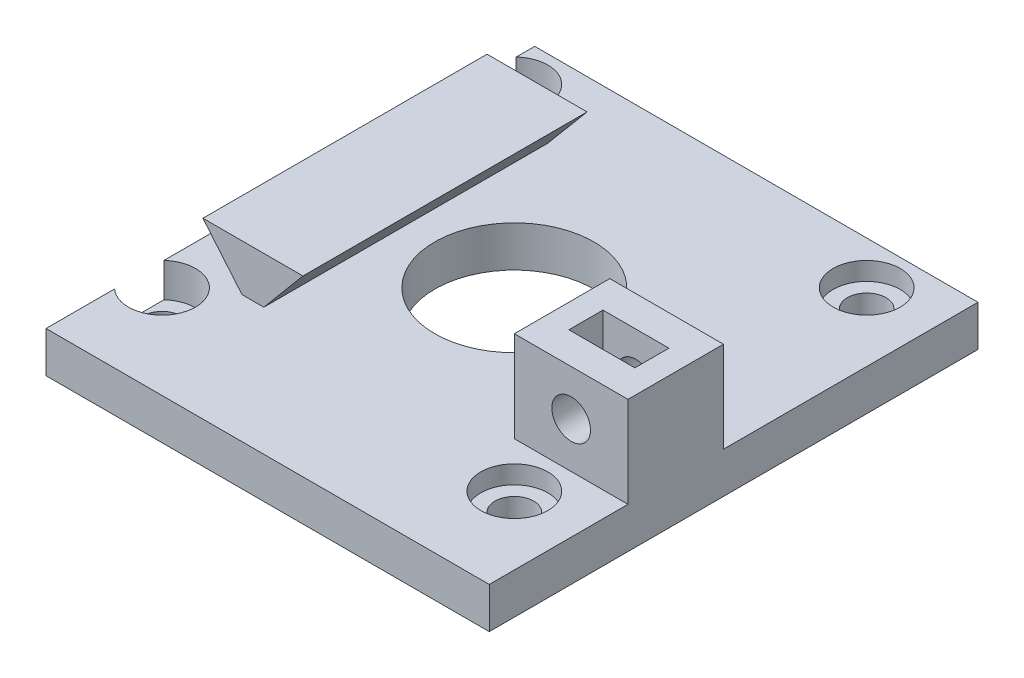
from build123d import *

# Parameters (mm, degrees)
CROQUIS1_W                   = 39
CROQUIS1_H                   = 43
CROQUIS1_R                   = 7
CROQUIS1_R_2                 = 1.7
SALIENTE_EXTRUIR1_DEPTH      = 3.6
CROQUIS2_R                   = 2.95
CORTAR_EXTRUIR1_DEPTH        = 1.6
CROQUIS3_W                   = 10
CROQUIS3_H                   = 8.4
SALIENTE_EXTRUIR2_DEPTH      = 8
CROQUIS4_R                   = 1.7
CORTAR_EXTRUIR2_DEPTH        = 11
CORTAR_EXTRUIR3_DEPTH        = 1.5
CORTAR_EXTRUIR3_DEPTH_BACK   = 1.5
SALIENTE_EXTRUIR3_DEPTH      = 12.5
SALIENTE_EXTRUIR3_DEPTH_BACK = 12.5
CORTAR_EXTRUIR4_DEPTH        = 3


with BuildPart() as part:
    # Croquis1 → Saliente-Extruir1 (new body)
    with BuildSketch(Plane(origin=(0, 0, 0), x_dir=(1, 0, 0), z_dir=(0, 1, 0))):
        with Locations((2, -2.205128205)):
            Rectangle(CROQUIS1_W, CROQUIS1_H)
        with Locations(Location((0, 0, 0), (0, 0, 270))):
            Circle(CROQUIS1_R, mode=Mode.SUBTRACT)
        with Locations(Location((-15.5, 15.5, 0), (0, 0, 270))):
            Circle(CROQUIS1_R_2, mode=Mode.SUBTRACT)
        with Locations(Location((15.5, 15.5, 0), (0, 0, 270))):
            Circle(CROQUIS1_R_2, mode=Mode.SUBTRACT)
        with Locations(Location((-15.5, -15.5, 0), (0, 0, 270))):
            Circle(CROQUIS1_R_2, mode=Mode.SUBTRACT)
        with Locations(Location((15.5, -15.5, 0), (0, 0, 270))):
            Circle(CROQUIS1_R_2, mode=Mode.SUBTRACT)
    extrude(amount=SALIENTE_EXTRUIR1_DEPTH)

    # Croquis2 → Cortar-Extruir1 (cut)
    with BuildSketch(Plane(origin=(0, 3.6, 0), x_dir=(1, 0, 0), z_dir=(0, 1, 0))):
        with Locations((-15.5, 15.5)):
            Circle(CROQUIS2_R)
        with Locations(Location((15.5, 15.5, 0), (0, 0, 270))):
            Circle(CROQUIS2_R)
        with Locations((-15.5, -15.5)):
            Circle(CROQUIS2_R)
        with Locations(Location((15.5, -15.5, 0), (0, 0, 270))):
            Circle(CROQUIS2_R)
    extrude(amount=-CORTAR_EXTRUIR1_DEPTH, mode=Mode.SUBTRACT)

    # Croquis3 → Saliente-Extruir2 (add)
    with BuildSketch(Plane(origin=(0, 3.6, 0), x_dir=(1, 0, 0), z_dir=(0, 1, 0))):
        with Locations((16.5, -7.3)):
            Rectangle(CROQUIS3_W, CROQUIS3_H)
    extrude(amount=SALIENTE_EXTRUIR2_DEPTH)

    # Croquis4 → Cortar-Extruir2 (cut)
    with BuildSketch(Plane.XY.offset(11.5)):
        with Locations((16.5, 7.6)):
            Circle(CROQUIS4_R)
    extrude(amount=-CORTAR_EXTRUIR2_DEPTH, mode=Mode.SUBTRACT)

    # Croquis5 → Cortar-Extruir3 (cut, two sides: drawn at the far end of the back side and taken through both)
    with BuildSketch(Plane.XY.offset(7.3).offset(-CORTAR_EXTRUIR3_DEPTH_BACK)):
        Polygon((13.598814897, 9.275), (13.598814897, 15.925), (19.401185103, 15.925), (19.401185103, 9.275), (19.401185103, 5.925), (16.5, 4.25), (13.598814897, 5.925), align=None)
    extrude(amount=CORTAR_EXTRUIR3_DEPTH + CORTAR_EXTRUIR3_DEPTH_BACK, mode=Mode.SUBTRACT)

    # Croquis6 → Saliente-Extruir3 (add, two sides: drawn at the far end of the back side and taken through both)
    with BuildSketch(Plane.XY.offset(-SALIENTE_EXTRUIR3_DEPTH_BACK)):
        Polygon((-10.5, 2.456284193), (-14.9, 7.7), (-6.1, 7.7), align=None)
    extrude(amount=SALIENTE_EXTRUIR3_DEPTH + SALIENTE_EXTRUIR3_DEPTH_BACK)

    # Croquis7 → Cortar-Extruir4 (cut)
    with BuildSketch(Plane(origin=(0, 3.6, 0), x_dir=(1, 0, 0), z_dir=(0, 1, 0))):
        with BuildLine():
            Line((-17.5, -13.331475156), (-17.5, -17.668524844))
            ThreePointArc((-17.5, -17.668524844), (-12.55, -15.5), (-17.5, -13.331475156))
        make_face()
        with BuildLine():
            Line((-17.5, 17.668524844), (-17.5, 13.331475156))
            ThreePointArc((-17.5, 13.331475156), (-12.55, 15.5), (-17.5, 17.668524844))
        make_face()
    extrude(amount=-CORTAR_EXTRUIR4_DEPTH, mode=Mode.SUBTRACT)


solid = part.part
